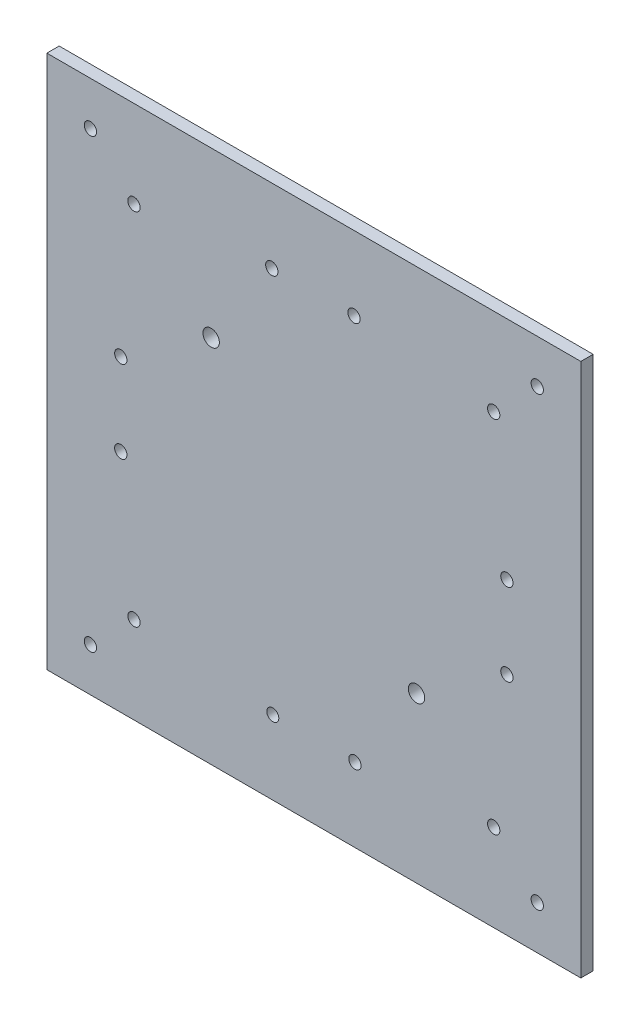
from build123d import *

# Parameters (mm, degrees)
SKETCH_1_W          = 130
SKETCH_1_H          = 130
EXTRUDE_1_DEPTH     = 3
SKETCH_5_R          = 2
CUT_EXTRUDE_4_DEPTH = 3
SKETCH_6_R          = 1.5
SKETCH_6_R_2        = 1.464964174
CUT_EXTRUDE_5_DEPTH = 10


with BuildPart() as part:
    # 草图1 → 凸台-拉伸1 (new body)
    with BuildSketch(Plane.XY):
        Rectangle(SKETCH_1_W, SKETCH_1_H)
    extrude(amount=EXTRUDE_1_DEPTH)

    # 草图5 → 切除-拉伸4 (cut)
    with BuildSketch(Plane.XY.offset(3)):
        with Locations((25, -25)):
            Circle(SKETCH_5_R)
        with Locations((-25, 25)):
            Circle(SKETCH_5_R)
    extrude(amount=-CUT_EXTRUDE_4_DEPTH, mode=Mode.SUBTRACT)

    # 草图6 → 切除-拉伸5 (cut)
    with BuildSketch(Plane.XY.offset(3)):
        with Locations((-54.393398282, 54.393398282)):
            Circle(SKETCH_6_R)
        with Locations((-43.786796564, 43.786796564)):
            Circle(SKETCH_6_R)
        with Locations((-10.232887384, 47)):
            Circle(SKETCH_6_R)
        with Locations((9.767112616, 47)):
            Circle(SKETCH_6_R)
        with Locations((43.786796564, 43.786796564)):
            Circle(SKETCH_6_R)
        with Locations((54.393398282, 54.393398282)):
            Circle(SKETCH_6_R)
        with Locations((-47, 10)):
            Circle(SKETCH_6_R)
        with Locations((-47, -10)):
            Circle(SKETCH_6_R)
        with Locations((47, -10)):
            Circle(SKETCH_6_R)
        with Locations((47, 10)):
            Circle(SKETCH_6_R)
        with Locations((-54.393398282, -54.393398282)):
            Circle(SKETCH_6_R)
        with Locations((-43.786796564, -43.786796564)):
            Circle(SKETCH_6_R)
        with Locations((-10, -47)):
            Circle(SKETCH_6_R_2)
        with Locations((10, -47)):
            Circle(SKETCH_6_R)
        with Locations((43.786796564, -43.786796564)):
            Circle(SKETCH_6_R)
        with Locations((54.393398282, -54.393398282)):
            Circle(SKETCH_6_R)
    extrude(amount=-CUT_EXTRUDE_5_DEPTH, mode=Mode.SUBTRACT)


solid = part.part
